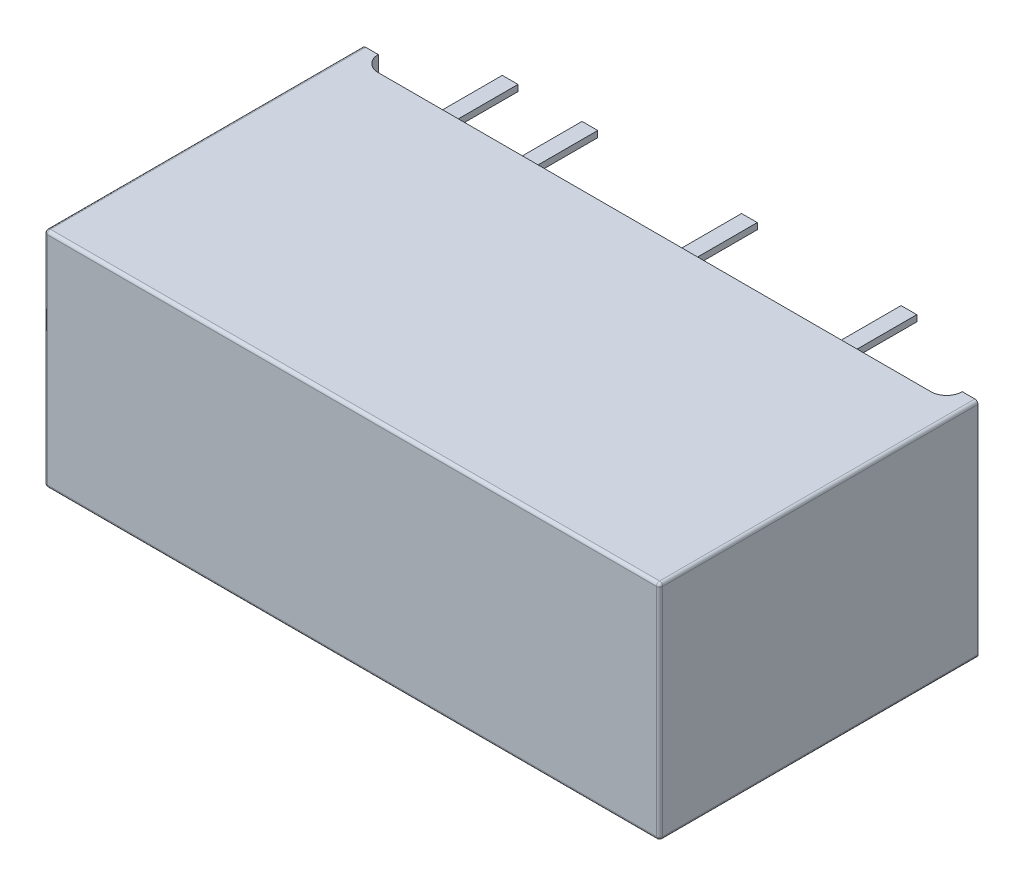
from build123d import *

# Parameters (mm, degrees)
EXTRUDE_1_DEPTH = 3.55
EXTRUDE_2_DEPTH = 0.01
FILLET_1_R      = 0.1
SKETCH_3_W      = 0.5
SKETCH_3_H      = 0.2
EXTRUDE_4_DEPTH = 3


with BuildPart() as part:
    # Эскиз1 → Бобышка-Вытянуть1 (new, symmetric)
    with BuildSketch(Plane(origin=(0, 0, 0), x_dir=(1, 0, 0), z_dir=(0, 1, 0))):
        with BuildLine():
            Line((-9.8, 0), (-9.3, 0))
            ThreePointArc((-9.3, 0), (-9.153553391, -0.353553391), (-8.8, -0.5))
            Line((-8.8, -0.5), (8.8, -0.5))
            ThreePointArc((8.8, -0.5), (9.153553391, -0.353553391), (9.3, 0))
            Line((9.3, 0), (9.8, 0))
            Line((9.8, 0), (9.8, -10.14))
            Line((9.8, -10.14), (-9.8, -10.14))
            Line((-9.8, -10.14), (-9.8, 0))
        make_face()
    extrude(amount=EXTRUDE_1_DEPTH, both=True)

    # Эскиз2 → Бобышка-Вытянуть2 (add)
    # profile 1 of 9: a face of its own
    with BuildSketch(Plane.XZ.offset(3.55)):
        with BuildLine():
            Line((-6.551857487, 8.255491259), (-6.906364699, 7.946446788))
            add(Edge.make_bspline(
                [(-6.906364699, 7.946446788), (-6.924082128, 7.970380302), (-6.958037255, 8.016248443), (-7.011917074, 8.077769979), (-7.063535919, 8.131231452), (-7.115530997, 8.173864681), (-7.166211394, 8.207670363), (-7.21601875, 8.232158507), (-7.265233036, 8.247633093), (-7.298060996, 8.249484395), (-7.31399691, 8.250383086)],
                knots=[0, 0, 0, 0, 1.358515141, 2.603569235, 3.730126198, 4.746094498, 5.666493297, 6.504166865, 7.273866877, 8, 8, 8, 8], degree=3))
            add(Edge.make_bspline(
                [(-7.31399691, 8.250383086), (-7.329049743, 8.249731403), (-7.357998345, 8.248478132), (-7.399552139, 8.237793206), (-7.437319109, 8.220605844), (-7.469743567, 8.195742206), (-7.496824434, 8.16707546), (-7.516932345, 8.134906022), (-7.528642932, 8.099448213), (-7.530266189, 8.074916674), (-7.531094266, 8.062402316)],
                knots=[0, 0, 0, 0, 1.130304997, 2.173727141, 3.204821236, 4.229135679, 5.225705988, 6.15679035, 7.05971714, 8, 8, 8, 8], degree=3))
            add(Edge.make_bspline(
                [(-7.531094266, 8.062402316), (-7.530340118, 8.050073912), (-7.528753916, 8.024143557), (-7.517132571, 7.984833533), (-7.499553749, 7.943414419), (-7.47841019, 7.907400445), (-7.454670528, 7.874698634), (-7.42979285, 7.842700157), (-7.397309205, 7.804442044), (-7.357782095, 7.759486271), (-7.31158914, 7.707453528), (-7.257532245, 7.649100899), (-7.196584727, 7.584045147), (-7.153294944, 7.53861109), (-7.130613497, 7.514806163)],
                knots=[0, 0, 0, 0, 0.642317819, 1.35098826, 2.122816345, 2.986294386, 3.520967692, 4.229638134, 5.099348126, 6.137609051, 7.351336444, 8.727500291, 10.285391505, 12, 12, 12, 12], degree=3))
            add(Edge.make_bspline(
                [(-7.130613497, 7.514806163), (-7.118309393, 7.502078178), (-7.094700207, 7.477655648), (-7.061573393, 7.441987342), (-7.03200703, 7.408929596), (-7.004708719, 7.37964021), (-6.981339618, 7.352606879), (-6.961386815, 7.328478172), (-6.94444809, 7.307593617), (-6.934433739, 7.294493951), (-6.929862295, 7.288514095)],
                knots=[0, 0, 0, 0, 1.403722598, 2.693470914, 3.859630393, 4.920438112, 5.867965235, 6.69256451, 7.40316977, 8, 8, 8, 8], degree=3))
            add(Edge.make_bspline(
                [(-6.929862295, 7.288514095), (-6.911658524, 7.263365363), (-6.876548877, 7.214860957), (-6.831009057, 7.141113603), (-6.793342543, 7.07005944), (-6.763744246, 7.000857549), (-6.741602763, 6.932751031), (-6.725566348, 6.864614084), (-6.715464679, 6.795879947), (-6.714344295, 6.749635371), (-6.713786574, 6.726615057)],
                knots=[0, 0, 0, 0, 1.215130546, 2.343624586, 3.390252636, 4.360992906, 5.286454858, 6.190345157, 7.099163061, 8, 8, 8, 8], degree=3))
            add(Edge.make_bspline(
                [(-6.713786574, 6.726615057), (-6.714480594, 6.701207097), (-6.715846428, 6.651204104), (-6.726429968, 6.577840317), (-6.742914648, 6.507496209), (-6.767495806, 6.440594397), (-6.797847536, 6.376406871), (-6.836370332, 6.315873551), (-6.880685854, 6.257970215), (-6.93184558, 6.204064805), (-6.987840721, 6.154768555), (-7.048813238, 6.112079645), (-7.113261136, 6.075693008), (-7.181839564, 6.04573703), (-7.254339544, 6.022953052), (-7.33063174, 6.006747557), (-7.410575314, 5.995990407), (-7.465332901, 5.995079164), (-7.493293785, 5.994613855)],
                knots=[0, 0, 0, 0, 1.018989505, 2.005376454, 2.968035412, 3.912365187, 4.859556873, 5.811049809, 6.78527381, 7.780773345, 8.787785161, 9.773320145, 10.761314359, 11.752515283, 12.770107012, 13.804505292, 14.878913802, 16, 16, 16, 16], degree=3))
            add(Edge.make_bspline(
                [(-7.493293785, 5.994613855), (-7.514759451, 5.995043962), (-7.55725273, 5.995895399), (-7.620235549, 6.001548513), (-7.68169126, 6.011199114), (-7.74152955, 6.025125649), (-7.799875363, 6.042514906), (-7.856819663, 6.063387727), (-7.912219964, 6.088651844), (-7.966147218, 6.117650313), (-8.018606408, 6.150496548), (-8.06928276, 6.187582339), (-8.118723039, 6.22819252), (-8.16627924, 6.273096218), (-8.212955442, 6.321053932), (-8.25793412, 6.373156646), (-8.300763316, 6.429622736), (-8.327951343, 6.46905542), (-8.341761333, 6.489085009)],
                knots=[0, 0, 0, 0, 1.003438088, 1.986398949, 2.953471805, 3.909242729, 4.856156023, 5.798037682, 6.742035895, 7.700024963, 8.658509928, 9.632892881, 10.633707184, 11.647385023, 12.688779161, 13.761077638, 14.862753205, 16, 16, 16, 16], degree=3))
            Line((-8.341761333, 6.489085009), (-7.964267343, 6.785869864))
            add(Edge.make_bspline(
                [(-7.964267343, 6.785869864), (-7.945464927, 6.756958733), (-7.909403088, 6.701509021), (-7.850623955, 6.626661736), (-7.790698874, 6.563049892), (-7.729410259, 6.510920821), (-7.666560932, 6.470360392), (-7.602602045, 6.441367472), (-7.53724895, 6.42271927), (-7.49290248, 6.420646233), (-7.470817824, 6.419613855)],
                knots=[0, 0, 0, 0, 1.289844872, 2.473840458, 3.555310637, 4.554525788, 5.477014656, 6.343795492, 7.175205895, 8, 8, 8, 8], degree=3))
            add(Edge.make_bspline(
                [(-7.470817824, 6.419613855), (-7.450440922, 6.420506879), (-7.410773426, 6.422245319), (-7.354029259, 6.438431395), (-7.301968636, 6.463383281), (-7.256897713, 6.499010653), (-7.218928619, 6.540852622), (-7.191328478, 6.588519585), (-7.174712518, 6.640746996), (-7.172572948, 6.676945261), (-7.171478881, 6.695455201)],
                knots=[0, 0, 0, 0, 1.07813582, 2.098795369, 3.104167493, 4.120866408, 5.124778177, 6.083335831, 7.019916046, 8, 8, 8, 8], degree=3))
            add(Edge.make_bspline(
                [(-7.171478881, 6.695455201), (-7.172001544, 6.710500086), (-7.173064736, 6.741104156), (-7.184147496, 6.786685566), (-7.200596145, 6.832904909), (-7.220532391, 6.871967239), (-7.242034925, 6.906219764), (-7.26480632, 6.937237852), (-7.293459265, 6.97364583), (-7.328906985, 7.014589137), (-7.369700481, 7.061450018), (-7.417385422, 7.112581566), (-7.47043825, 7.169675873), (-7.508530646, 7.20873955), (-7.52854018, 7.229259288)],
                knots=[0, 0, 0, 0, 0.82235112, 1.672813781, 2.554588539, 3.50524042, 4.06657461, 4.767804758, 5.610876414, 6.602916144, 7.732569792, 9.01260869, 10.430754915, 12, 12, 12, 12], degree=3))
            add(Edge.make_bspline(
                [(-7.52854018, 7.229259288), (-7.549718241, 7.25116303), (-7.590658821, 7.293506467), (-7.648578778, 7.355475805), (-7.700750892, 7.413153507), (-7.747116088, 7.466600264), (-7.787712667, 7.515912151), (-7.823243089, 7.560715078), (-7.852631956, 7.601600062), (-7.869207095, 7.628127215), (-7.876917583, 7.64046722)],
                knots=[0, 0, 0, 0, 1.354401886, 2.618275412, 3.770529779, 4.811580489, 5.763301005, 6.60974666, 7.35327647, 8, 8, 8, 8], degree=3))
            add(Edge.make_bspline(
                [(-7.876917583, 7.64046722), (-7.894133635, 7.671216641), (-7.927535747, 7.730875826), (-7.961970849, 7.824773802), (-7.984410853, 7.917465436), (-7.987344319, 7.979358205), (-7.988786574, 8.009788134)],
                knots=[0, 0, 0, 0, 1.081804801, 2.098888081, 3.065307629, 4, 4, 4, 4], degree=3))
            add(Edge.make_bspline(
                [(-7.988786574, 8.009788134), (-7.988268708, 8.029393008), (-7.987238576, 8.068390766), (-7.979822421, 8.125946326), (-7.968467145, 8.182226855), (-7.950364962, 8.236378675), (-7.929487924, 8.289757751), (-7.902199044, 8.340961492), (-7.871539887, 8.391367445), (-7.846942991, 8.422592767), (-7.834519747, 8.438363855)],
                knots=[0, 0, 0, 0, 1.012167245, 2.013389743, 2.992947912, 3.971795425, 4.958040075, 5.949133471, 6.964161297, 8, 8, 8, 8], degree=3))
            add(Edge.make_bspline(
                [(-7.834519747, 8.438363855), (-7.818119988, 8.457371055), (-7.785773754, 8.494860103), (-7.729808628, 8.542781762), (-7.670470032, 8.584175173), (-7.606480672, 8.617405738), (-7.538576371, 8.643890886), (-7.466111308, 8.661862831), (-7.389640845, 8.673603828), (-7.337199227, 8.674781656), (-7.310421189, 8.675383086)],
                knots=[0, 0, 0, 0, 1.010152455, 1.992384693, 2.959065588, 3.919519142, 4.890305168, 5.888624478, 6.921877408, 8, 8, 8, 8], degree=3))
            add(Edge.make_bspline(
                [(-7.310421189, 8.675383086), (-7.273391262, 8.674090316), (-7.200344311, 8.671540139), (-7.092881406, 8.651718957), (-6.990475528, 8.61812036), (-6.8921025, 8.572471212), (-6.799359585, 8.512353923), (-6.71100817, 8.4396832), (-6.627097008, 8.353941064), (-6.577404603, 8.288919283), (-6.551857487, 8.255491259)],
                knots=[0, 0, 0, 0, 0.984438778, 1.941949542, 2.894274057, 3.844399604, 4.817935388, 5.825099055, 6.88187249, 8, 8, 8, 8], degree=3))
        make_face()
    # profile 2 of 9: a face of its own
    with BuildSketch(Plane.XZ.offset(3.55)):
        with BuildLine():
            Line((-5.996599074, 8.60999847), (-5.560361093, 8.60999847))
            add(Edge.make_bspline(
                [(-5.560361093, 8.60999847), (-5.528515797, 8.609868772), (-5.467186923, 8.609618995), (-5.378787696, 8.605874495), (-5.297514859, 8.600441972), (-5.223569038, 8.592833893), (-5.15696502, 8.583572059), (-5.097897843, 8.570998092), (-5.045623516, 8.557591421), (-5.014193096, 8.544923459), (-4.999483689, 8.538994864)],
                knots=[0, 0, 0, 0, 1.344208059, 2.588726621, 3.734329264, 4.782131975, 5.726482068, 6.570895881, 7.331180631, 8, 8, 8, 8], degree=3))
            add(Edge.make_bspline(
                [(-4.999483689, 8.538994864), (-4.983022464, 8.53156736), (-4.95057624, 8.516927229), (-4.904732826, 8.491317607), (-4.862053619, 8.463459534), (-4.822137688, 8.433968507), (-4.785277096, 8.402197095), (-4.751257393, 8.368401026), (-4.72068677, 8.332031473), (-4.692960214, 8.293645321), (-4.668563916, 8.253235758), (-4.646887682, 8.211384081), (-4.629149033, 8.167683577), (-4.614033459, 8.122567056), (-4.602969279, 8.07532656), (-4.594946812, 8.026514839), (-4.589475516, 7.976026994), (-4.589018904, 7.941864161), (-4.588786574, 7.924481643)],
                knots=[0, 0, 0, 0, 1.101151138, 2.170445781, 3.198860437, 4.208379212, 5.195204417, 6.164605257, 7.130047863, 8.089887807, 9.049952485, 10.006809717, 10.961522665, 11.923831799, 12.906274987, 13.917075149, 14.940179313, 16, 16, 16, 16], degree=3))
            add(Edge.make_bspline(
                [(-4.588786574, 7.924481643), (-4.589223308, 7.905399019), (-4.590090842, 7.867493055), (-4.595669829, 7.811463335), (-4.605420512, 7.756810444), (-4.619429659, 7.70364595), (-4.636553739, 7.651413419), (-4.658270438, 7.600856538), (-4.683198721, 7.551504428), (-4.712497565, 7.504322665), (-4.744211904, 7.458854575), (-4.779748365, 7.416937603), (-4.817618051, 7.378196931), (-4.857621258, 7.341784491), (-4.90110621, 7.309584863), (-4.946549029, 7.279573531), (-4.995027886, 7.253528263), (-5.046759957, 7.230059418), (-5.104533299, 7.209824375), (-5.169762886, 7.192236663), (-5.243799, 7.176975184), (-5.32634736, 7.164510866), (-5.417682286, 7.154299309), (-5.517548142, 7.147036252), (-5.626196418, 7.141159606), (-5.701508785, 7.139636703), (-5.740679603, 7.138844624)],
                knots=[0, 0, 0, 0, 0.866399648, 1.721027061, 2.553550129, 3.384204618, 4.21539855, 5.04677222, 5.880012857, 6.723270778, 7.566245156, 8.394738354, 9.214784533, 10.025005932, 10.847562629, 11.668810448, 12.495570546, 13.343317016, 14.245569203, 15.271435576, 16.408570332, 17.675782105, 19.060520395, 20.580184572, 22.221315141, 24, 24, 24, 24], degree=3))
            Line((-5.740679603, 7.138844624), (-5.892392343, 6.05999847))
            Line((-5.892392343, 6.05999847), (-6.354171189, 6.05999847))
            Line((-6.354171189, 6.05999847), (-5.996599074, 8.60999847))
        make_face()
        with BuildLine():
            add(Edge.make_bspline(
                [(-5.681424795, 7.563844624), (-5.649921764, 7.564380263), (-5.589954903, 7.565399867), (-5.504211414, 7.569120224), (-5.42702052, 7.576319933), (-5.358238291, 7.585639955), (-5.297999358, 7.597891984), (-5.246096488, 7.612138758), (-5.202958827, 7.629984034), (-5.167243785, 7.650098073), (-5.138901863, 7.674047946), (-5.113782467, 7.699153947), (-5.092778718, 7.727360192), (-5.075901292, 7.758413103), (-5.062403167, 7.791775658), (-5.053379804, 7.828062606), (-5.047703434, 7.866750717), (-5.046892763, 7.893471675), (-5.046478881, 7.907113855)],
                knots=[0, 0, 0, 0, 1.839895187, 3.502289619, 5.0101303, 6.365671836, 7.553232357, 8.598057788, 9.502875839, 10.27370316, 10.980290013, 11.662314044, 12.34441055, 13.025273935, 13.721358838, 14.440015487, 15.203561875, 16, 16, 16, 16], degree=3))
            add(Edge.make_bspline(
                [(-5.046478881, 7.907113855), (-5.047098692, 7.922302361), (-5.048307192, 7.951916741), (-5.056744996, 7.994494889), (-5.072113773, 8.033108038), (-5.092333432, 8.06812454), (-5.118906292, 8.098705836), (-5.151000834, 8.124591111), (-5.188952172, 8.145107398), (-5.225052239, 8.157752954), (-5.258593257, 8.16582449), (-5.290059161, 8.170604935), (-5.327001227, 8.175273558), (-5.369629961, 8.178570587), (-5.417635955, 8.181778316), (-5.471464497, 8.183720792), (-5.530900918, 8.184590695), (-5.572450179, 8.184858887), (-5.594075035, 8.18499847)],
                knots=[0, 0, 0, 0, 1.03742853, 2.022766538, 2.947121861, 3.864647693, 4.771646501, 5.697975149, 6.666071958, 7.703435297, 8.301453266, 9.020359131, 9.87578453, 10.844509861, 11.939964187, 13.162010635, 14.522931311, 16, 16, 16, 16], degree=3))
            Line((-5.594075035, 8.18499847), (-5.681424795, 7.563844624))
        make_face(mode=Mode.SUBTRACT)
    # profile 3 of 9: a face of its own
    with BuildSketch(Plane.XZ.offset(3.55)):
        with BuildLine():
            Line((-4.035060612, 8.60999847), (-3.592182006, 8.60999847))
            add(Edge.make_bspline(
                [(-3.592182006, 8.60999847), (-3.559315626, 8.60986416), (-3.495945294, 8.609605192), (-3.404816694, 8.605922682), (-3.321176143, 8.600366907), (-3.245123092, 8.593034963), (-3.176594046, 8.5828623), (-3.115731513, 8.570647981), (-3.062146753, 8.557045634), (-3.030012161, 8.544405447), (-3.014958449, 8.538484047)],
                knots=[0, 0, 0, 0, 1.348808202, 2.600664361, 3.742342956, 4.788858012, 5.735658768, 6.584006912, 7.336666444, 8, 8, 8, 8], degree=3))
            add(Edge.make_bspline(
                [(-3.014958449, 8.538484047), (-2.998009904, 8.530841063), (-2.964878182, 8.515900239), (-2.917402355, 8.490574625), (-2.872944938, 8.463292066), (-2.832242733, 8.433023919), (-2.794436799, 8.401044679), (-2.759761564, 8.367050181), (-2.728496239, 8.330518715), (-2.700312699, 8.29210552), (-2.675252018, 8.251860279), (-2.653740005, 8.209584531), (-2.635138939, 8.165636194), (-2.620613049, 8.119537032), (-2.608540289, 8.071840416), (-2.600732065, 8.022245411), (-2.595237005, 7.97091931), (-2.59478548, 7.936075596), (-2.594555805, 7.918351836)],
                knots=[0, 0, 0, 0, 1.116361014, 2.182309107, 3.229450697, 4.24598407, 5.225421932, 6.201651319, 7.158895679, 8.110002388, 9.060669178, 10.002827475, 10.956240434, 11.923213192, 12.902917952, 13.908279153, 14.936015885, 16, 16, 16, 16], degree=3))
            add(Edge.make_bspline(
                [(-2.594555805, 7.918351836), (-2.595095943, 7.896541529), (-2.596162262, 7.853484453), (-2.603129821, 7.789991002), (-2.616125183, 7.729062445), (-2.633626016, 7.670506849), (-2.655308143, 7.613945076), (-2.683270083, 7.560361341), (-2.715590608, 7.508822013), (-2.752917517, 7.460002808), (-2.794639324, 7.413455886), (-2.842813393, 7.371920588), (-2.894774668, 7.332603547), (-2.952657789, 7.298140796), (-3.014870829, 7.266127969), (-3.082832779, 7.239004757), (-3.155268099, 7.213974219), (-3.206058425, 7.201446783), (-3.232055805, 7.195034528)],
                knots=[0, 0, 0, 0, 0.995453645, 1.965186658, 2.910129054, 3.83459069, 4.752398018, 5.669942118, 6.588407184, 7.525617038, 8.471772905, 9.435289717, 10.423772802, 11.441988612, 12.505459691, 13.613754905, 14.778583949, 16, 16, 16, 16], degree=3))
            Line((-3.232055805, 7.195034528), (-2.643594266, 6.05999847))
            Line((-2.643594266, 6.05999847), (-3.154922391, 6.05999847))
            Line((-3.154922391, 6.05999847), (-3.731124314, 7.171536932))
            Line((-3.731124314, 7.171536932), (-3.774543785, 7.171536932))
            Line((-3.774543785, 7.171536932), (-3.930853881, 6.05999847))
            Line((-3.930853881, 6.05999847), (-4.392632728, 6.05999847))
            Line((-4.392632728, 6.05999847), (-4.035060612, 8.60999847))
        make_face()
        with BuildLine():
            add(Edge.make_bspline(
                [(-3.71477816, 7.596536932), (-3.681910792, 7.596842123), (-3.619043785, 7.597425877), (-3.529257273, 7.601486309), (-3.448290552, 7.607900317), (-3.376377131, 7.617066353), (-3.31332784, 7.627906456), (-3.259410514, 7.641439551), (-3.214378022, 7.657530155), (-3.177520087, 7.676612005), (-3.14766262, 7.699015957), (-3.1218197, 7.722924486), (-3.10030082, 7.749687438), (-3.082545815, 7.778855517), (-3.068851965, 7.810489182), (-3.058976582, 7.844802746), (-3.053516404, 7.881567419), (-3.052677019, 7.906926426), (-3.052248112, 7.919884288)],
                knots=[0, 0, 0, 0, 1.892208387, 3.619318591, 5.173427176, 6.566868293, 7.791773198, 8.8545744, 9.763297566, 10.539470204, 11.233547833, 11.906251103, 12.5615143, 13.203742025, 13.866659999, 14.539934446, 15.25394049, 16, 16, 16, 16], degree=3))
            add(Edge.make_bspline(
                [(-3.052248112, 7.919884288), (-3.052803315, 7.934576632), (-3.053880332, 7.963077766), (-3.063196089, 8.004127619), (-3.079125714, 8.04136541), (-3.10151263, 8.074435131), (-3.129450298, 8.103594374), (-3.163532722, 8.127610373), (-3.203370452, 8.146515586), (-3.240688903, 8.159005687), (-3.276012772, 8.166240274), (-3.308941425, 8.171100947), (-3.347928031, 8.175791323), (-3.393089858, 8.179259708), (-3.444372617, 8.18155398), (-3.501750198, 8.183783359), (-3.565106848, 8.184576139), (-3.609379637, 8.184853432), (-3.632536574, 8.18499847)],
                knots=[0, 0, 0, 0, 0.974340854, 1.890087692, 2.776057671, 3.647490651, 4.526730822, 5.442477659, 6.397820337, 7.445016909, 8.045730266, 8.789007992, 9.653967296, 10.651691253, 11.794598421, 13.061237498, 14.462876682, 16, 16, 16, 16], degree=3))
            Line((-3.632536574, 8.18499847), (-3.71477816, 7.596536932))
        make_face(mode=Mode.SUBTRACT)
    # profile 4 of 9: a face of its own
    with BuildSketch(Plane.XZ.offset(3.55)):
        with BuildLine():
            add(Edge.make_bspline(
                [(-1.350204843, 8.675383086), (-1.326306607, 8.674642165), (-1.279208206, 8.673181965), (-1.210344761, 8.660270855), (-1.144171334, 8.640714142), (-1.081605328, 8.611303371), (-1.02121198, 8.575279371), (-0.965051385, 8.529383492), (-0.91106701, 8.476629784), (-0.860640694, 8.415780626), (-0.814392801, 8.347286741), (-0.774742617, 8.270473048), (-0.740382469, 8.186641811), (-0.713108848, 8.095189209), (-0.691607566, 7.996493978), (-0.676676184, 7.890289671), (-0.66732934, 7.776682908), (-0.666259918, 7.698549219), (-0.665709651, 7.658345826)],
                knots=[0, 0, 0, 0, 0.836471817, 1.648510141, 2.446693269, 3.247435573, 4.063800371, 4.904091908, 5.781463953, 6.704836402, 7.667709944, 8.670923685, 9.727683881, 10.837250621, 12.009625467, 13.263198326, 14.591789123, 16, 16, 16, 16], degree=3))
            add(Edge.make_bspline(
                [(-0.665709651, 7.658345826), (-0.6662326, 7.616278961), (-0.667264436, 7.533276312), (-0.67448086, 7.410385745), (-0.686644213, 7.290897598), (-0.703927299, 7.174789213), (-0.726532921, 7.062339761), (-0.753484674, 6.953154968), (-0.785703095, 6.847493336), (-0.822362557, 6.745785712), (-0.86225635, 6.649390099), (-0.905266328, 6.559530282), (-0.950780509, 6.477025499), (-0.997447286, 6.400672317), (-1.047713227, 6.332457425), (-1.099434646, 6.270557479), (-1.153345605, 6.215534309), (-1.210559899, 6.168567702), (-1.268830174, 6.127743421), (-1.328000436, 6.092103625), (-1.388228593, 6.061901182), (-1.4497184, 6.037199803), (-1.512192247, 6.018438527), (-1.575476262, 6.004359837), (-1.639951013, 5.995978219), (-1.683403937, 5.995069931), (-1.705222872, 5.994613855)],
                knots=[0, 0, 0, 0, 1.396844559, 2.756131219, 4.086127259, 5.383920942, 6.652453196, 7.89349539, 9.116895717, 10.318757433, 11.482194025, 12.579741648, 13.624829685, 14.610133714, 15.548779577, 16.435605836, 17.287197802, 18.102347136, 18.889788549, 19.648068299, 20.394000194, 21.124756219, 21.84557971, 22.557590164, 23.275725456, 24, 24, 24, 24], degree=3))
            add(Edge.make_bspline(
                [(-1.705222872, 5.994613855), (-1.735811494, 5.99585969), (-1.795756914, 5.998301189), (-1.883187117, 6.018551256), (-1.965435782, 6.051314585), (-2.029150722, 6.089506128), (-2.076817569, 6.126111966), (-2.110695354, 6.157478306), (-2.14385009, 6.190949317), (-2.173951231, 6.228778319), (-2.202281993, 6.269581875), (-2.229739332, 6.313113962), (-2.254565803, 6.360181099), (-2.27760898, 6.410472577), (-2.298853413, 6.464174228), (-2.31641302, 6.522181734), (-2.331967993, 6.584005538), (-2.34364636, 6.649981206), (-2.354451432, 6.719542239), (-2.360521681, 6.79327713), (-2.364793777, 6.870784977), (-2.365399933, 6.923783902), (-2.365709651, 6.950863855)],
                knots=[0, 0, 0, 0, 1.406247179, 2.755863859, 4.106117258, 5.46602111, 6.158742467, 6.868709005, 7.589063128, 8.324514997, 9.089670002, 9.87455016, 10.69128516, 11.536247762, 12.419471489, 13.346380782, 14.323181077, 15.351303999, 16.428392134, 17.561291642, 18.753934945, 20, 20, 20, 20], degree=3))
            add(Edge.make_bspline(
                [(-2.365709651, 6.950863855), (-2.365184746, 6.996675995), (-2.364147954, 7.087164077), (-2.356958071, 7.220941494), (-2.344846518, 7.350820069), (-2.327325827, 7.476546283), (-2.305655704, 7.598335591), (-2.278323864, 7.71585024), (-2.247092605, 7.829759535), (-2.221553361, 7.903325586), (-2.208888737, 7.939806163)],
                knots=[0, 0, 0, 0, 1.092573637, 2.158050095, 3.194115651, 4.202596009, 5.184740479, 6.143227219, 7.07924729, 8, 8, 8, 8], degree=3))
            add(Edge.make_bspline(
                [(-2.208888737, 7.939806163), (-2.196987076, 7.9706053), (-2.173714281, 8.030830675), (-2.133573194, 8.116604647), (-2.091439821, 8.196423826), (-2.046470954, 8.269684395), (-1.998844509, 8.336565626), (-1.948331614, 8.396903954), (-1.894957476, 8.451025046), (-1.838801304, 8.498398925), (-1.780734785, 8.539701295), (-1.722211157, 8.57639172), (-1.661968054, 8.606444345), (-1.601283687, 8.6316461), (-1.539763996, 8.651217134), (-1.477349447, 8.664915507), (-1.414164749, 8.674174708), (-1.371521407, 8.674980358), (-1.350204843, 8.675383086)],
                knots=[0, 0, 0, 0, 1.312439913, 2.566376662, 3.7626465, 4.899353607, 5.981447343, 7.024199363, 8.024692673, 8.999854102, 9.941079975, 10.856034809, 11.7431154, 12.614348406, 13.466487218, 14.305782657, 15.153094213, 16, 16, 16, 16], degree=3))
        make_face()
        with BuildLine():
            add(Edge.make_bspline(
                [(-1.397710853, 8.250383086), (-1.414373233, 8.249293699), (-1.4480398, 8.247092579), (-1.496965747, 8.228985224), (-1.54395712, 8.200286467), (-1.571339277, 8.174168801), (-1.585691622, 8.160479239)],
                knots=[0, 0, 0, 0, 0.932167559, 1.883457255, 2.89061511, 4, 4, 4, 4], degree=3))
            add(Edge.make_bspline(
                [(-1.585691622, 8.160479239), (-1.596365141, 8.148442752), (-1.618834944, 8.123103638), (-1.648184027, 8.078572291), (-1.678364281, 8.028553904), (-1.705913459, 7.970897001), (-1.733462339, 7.906986246), (-1.760800485, 7.836455492), (-1.785700172, 7.758762254), (-1.819507975, 7.646906067), (-1.8549382, 7.500742978), (-1.885597148, 7.32070215), (-1.904528026, 7.1372081), (-1.906849551, 7.013568738), (-1.908017343, 6.951374672)],
                knots=[0, 0, 0, 0, 0.454841493, 0.957528522, 1.506411314, 2.107825232, 2.764136245, 3.476658851, 4.247912131, 5.07291354, 6.784378205, 8.500722671, 10.239765365, 12, 12, 12, 12], degree=3))
            add(Edge.make_bspline(
                [(-1.908017343, 6.951374672), (-1.907814716, 6.926513637), (-1.907425946, 6.87881422), (-1.904684908, 6.810447712), (-1.898705579, 6.748314568), (-1.892151452, 6.692274889), (-1.882467026, 6.642612474), (-1.870704734, 6.599240692), (-1.857377581, 6.56188042), (-1.841155224, 6.530436276), (-1.823185579, 6.504087686), (-1.803219444, 6.481696856), (-1.782226493, 6.462321717), (-1.759083611, 6.446699141), (-1.734824962, 6.43423408), (-1.708454431, 6.426353844), (-1.680993135, 6.420132024), (-1.66184172, 6.419788588), (-1.652097872, 6.419613855)],
                knots=[0, 0, 0, 0, 1.809169144, 3.47114723, 4.976568932, 6.350508084, 7.575216927, 8.654321082, 9.618705548, 10.455493865, 11.22189838, 11.932917759, 12.63470061, 13.29454068, 13.959479695, 14.609946561, 15.292769288, 16, 16, 16, 16], degree=3))
            add(Edge.make_bspline(
                [(-1.652097872, 6.419613855), (-1.633685122, 6.421079992), (-1.595500192, 6.424120512), (-1.538935293, 6.447706788), (-1.482772595, 6.484945629), (-1.436251707, 6.526059356), (-1.398940378, 6.567394199), (-1.371727079, 6.607254615), (-1.344673949, 6.65362003), (-1.317530536, 6.706434886), (-1.292385691, 6.76686681), (-1.26673024, 6.833719065), (-1.241853927, 6.907679595), (-1.209673374, 7.016375913), (-1.174239845, 7.160615059), (-1.145220529, 7.342041838), (-1.126856802, 7.531284098), (-1.124567222, 7.660175478), (-1.123401958, 7.725773711)],
                knots=[0, 0, 0, 0, 0.585084729, 1.213366824, 1.923217654, 2.726038827, 3.183054462, 3.692969635, 4.259263019, 4.892137045, 5.581993971, 6.3422359, 7.172083011, 8.065836625, 9.951587279, 11.896519821, 13.911566738, 16, 16, 16, 16], degree=3))
            add(Edge.make_bspline(
                [(-1.123401958, 7.725773711), (-1.123555771, 7.748423427), (-1.1238532, 7.792221403), (-1.127302172, 7.855312812), (-1.133660608, 7.9133802), (-1.141177485, 7.966616992), (-1.152914939, 8.014508644), (-1.165019963, 8.057933623), (-1.181052162, 8.095778006), (-1.199000312, 8.129014857), (-1.219047997, 8.15750797), (-1.239907377, 8.182526613), (-1.262882848, 8.203079014), (-1.286717115, 8.220738061), (-1.312565559, 8.234215322), (-1.339859282, 8.243254941), (-1.368342838, 8.249176521), (-1.387805168, 8.249976118), (-1.397710853, 8.250383086)],
                knots=[0, 0, 0, 0, 1.651300251, 3.193135231, 4.60384893, 5.910135154, 7.108621979, 8.196635245, 9.19265296, 10.098222774, 10.945408105, 11.729089381, 12.467301952, 13.187443458, 13.887068836, 14.581941946, 15.278255209, 16, 16, 16, 16], degree=3))
        make_face(mode=Mode.SUBTRACT)
    # profile 5 of 9: a face of its own
    with BuildSketch(Plane.XZ.offset(3.55)):
        Polygon((0.210852849, 8.60999847), (0.967884099, 8.60999847), (0.613376888, 6.05999847), (0.151598042, 6.05999847), (0.446850445, 8.18499847), (0.058629292, 8.18499847), align=None)
    # profile 6 of 9: a face of its own
    with BuildSketch(Plane.XZ.offset(3.55)):
        Polygon((1.551237465, 7.923460009), (2.043665349, 7.923460009), (2.374164147, 7.386080201), (2.770047561, 7.923460009), (3.29005958, 7.923460009), (2.610672561, 7.000923951), (3.188917753, 6.05999847), (2.695979051, 6.05999847), (2.341982657, 6.636711211), (1.916982657, 6.05999847), (1.396970638, 6.05999847), (2.105474244, 7.021356643), align=None)
    # profile 7 of 9: a face of its own
    with BuildSketch(Plane.XZ.offset(3.55)):
        Polygon((3.704843234, 7.204229239), (4.630444195, 7.204229239), (4.577319195, 6.779229239), (3.649674965, 6.779229239), align=None)
    # profile 8 of 9: a face of its own
    with BuildSketch(Plane.XZ.offset(3.55)):
        Polygon((4.983929772, 7.923460009), (5.476357657, 7.923460009), (5.806856455, 7.386080201), (6.202739869, 7.923460009), (6.722751888, 7.923460009), (6.043364869, 7.000923951), (6.621610061, 6.05999847), (6.128671359, 6.05999847), (5.774674965, 6.636711211), (5.349674965, 6.05999847), (4.829662945, 6.05999847), (5.538166551, 7.021356643), align=None)
    # profile 9 of 9: a face of its own
    with BuildSketch(Plane.XZ.offset(3.55)):
        Polygon((6.945468234, 7.923460009), (7.437896119, 7.923460009), (7.768394917, 7.386080201), (8.16427833, 7.923460009), (8.684290349, 7.923460009), (8.00490333, 7.000923951), (8.583148522, 6.05999847), (8.09020982, 6.05999847), (7.736213426, 6.636711211), (7.311213426, 6.05999847), (6.791201407, 6.05999847), (7.499705013, 7.021356643), align=None)
    extrude(amount=EXTRUDE_2_DEPTH)

    # Скругление1
    fillet_1_edges = [part.edges().sort_by_distance(p)[0] for p in [
        (9.8, 3.55, 5.07),
        (0, -3.55, 10.14),
        (-9.8, -3.55, 5.07),
        (9.8, 0, 10.14),
        (-9.8, 0, 10.14),
        (-9.8, 3.55, 5.07),
        (0, 3.55, 10.14),
        (9.8, -3.55, 5.07),
    ]]
    fillet(fillet_1_edges, radius=FILLET_1_R)

    # Эскиз3 → Бобышка-Вытянуть4 (add)
    with BuildSketch(Plane(origin=(0, 0, 0.5), x_dir=(-1, 0, 0), z_dir=(0, 0, -1))):
        with Locations((7.6, 2.35)):
            Rectangle(SKETCH_3_W, SKETCH_3_H)
        with Locations((5.06, 2.35)):
            Rectangle(SKETCH_3_W, SKETCH_3_H)
        with Locations((-0.02, 2.35)):
            Rectangle(SKETCH_3_W, SKETCH_3_H)
        with Locations((-5.1, 2.35)):
            Rectangle(SKETCH_3_W, SKETCH_3_H)
    extrude(amount=EXTRUDE_4_DEPTH)


solid = part.part
